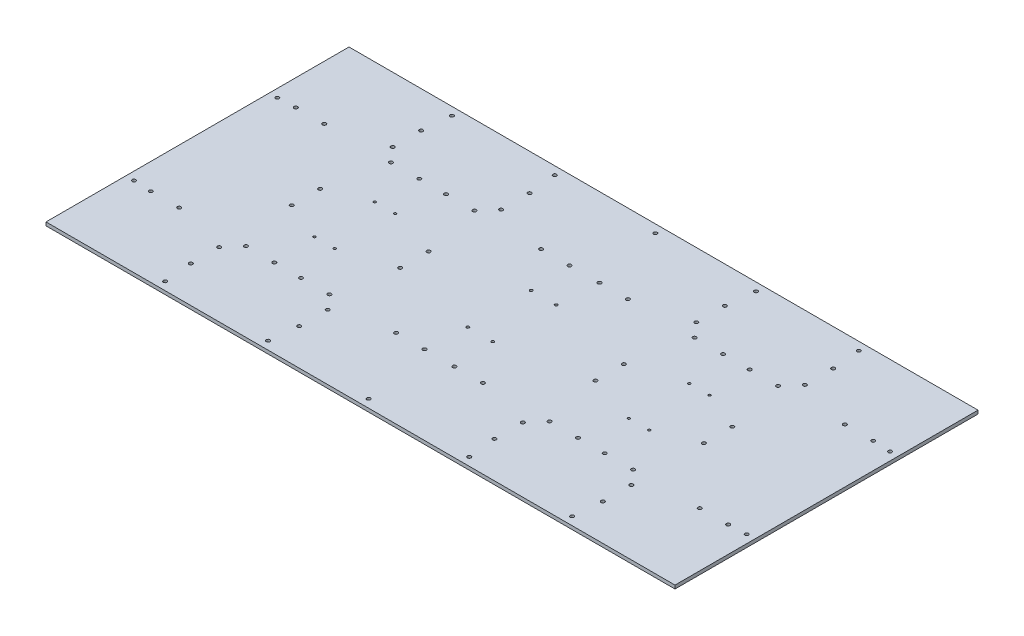
from build123d import *

# Parameters (mm, degrees)
SKETCH1_W           = 580
SKETCH1_H           = 279.4
SKETCH1_R           = 1.65
BOSS_EXTRUDE1_DEPTH = 3.175
SKETCH2_R           = 1.65
CUT_EXTRUDE1_DEPTH  = 3.175
SKETCH3_R           = 1.3
SKETCH3_R_2         = 1.1
CUT_EXTRUDE2_DEPTH  = 3.175


with BuildPart() as part:
    # Sketch1 → Boss-Extrude1 (new body)
    with BuildSketch(Plane(origin=(0, 0, 0), x_dir=(1, 0, 0), z_dir=(0, 1, 0))):
        Rectangle(SKETCH1_W, SKETCH1_H)
        with Locations(Location((-282.5, 66.1, 0), (0, 0, 270))):
            Circle(SKETCH1_R, mode=Mode.SUBTRACT)
        with Locations(Location((-187.633333333, 132.2, 0), (0, 0, 270))):
            Circle(SKETCH1_R, mode=Mode.SUBTRACT)
        with Locations(Location((-92.766666667, 132.2, 0), (0, 0, 270))):
            Circle(SKETCH1_R, mode=Mode.SUBTRACT)
        with Locations(Location((-282.5, -66.1, 0), (0, 0, 90))):
            Circle(SKETCH1_R, mode=Mode.SUBTRACT)
        with Locations(Location((-92.766666667, -132.2, 0), (0, 0, 90))):
            Circle(SKETCH1_R, mode=Mode.SUBTRACT)
        with Locations(Location((-187.633333333, -132.2, 0), (0, 0, 90))):
            Circle(SKETCH1_R, mode=Mode.SUBTRACT)
        with Locations(Location((187.633333333, -132.2, 0), (0, 0, 270))):
            Circle(SKETCH1_R, mode=Mode.SUBTRACT)
        with Locations(Location((92.766666667, -132.2, 0), (0, 0, 270))):
            Circle(SKETCH1_R, mode=Mode.SUBTRACT)
        with Locations(Location((92.766666667, 132.2, 0), (0, 0, 90))):
            Circle(SKETCH1_R, mode=Mode.SUBTRACT)
        with Locations(Location((187.633333333, 132.2, 0), (0, 0, 90))):
            Circle(SKETCH1_R, mode=Mode.SUBTRACT)
        with Locations(Location((282.5, -66.1, 0), (0, 0, 270))):
            Circle(SKETCH1_R, mode=Mode.SUBTRACT)
        with Locations(Location((282.5, 66.1, 0), (0, 0, 90))):
            Circle(SKETCH1_R, mode=Mode.SUBTRACT)
        with Locations(Location((0, 132.2, 0), (0, 0, 270))):
            Circle(SKETCH1_R, mode=Mode.SUBTRACT)
        with Locations(Location((0, -132.2, 0), (0, 0, 270))):
            Circle(SKETCH1_R, mode=Mode.SUBTRACT)
    extrude(amount=BOSS_EXTRUDE1_DEPTH)

    # Sketch2 → Cut-Extrude1 (cut)
    with BuildSketch(Plane(origin=(0, 3.175, 0), x_dir=(1, 0, 0), z_dir=(0, 1, 0))):
        with Locations(Location((-190, 13.1, 0), (0, 0, 270))):
            Circle(SKETCH2_R)
        with Locations(Location((-266.2, 66.873878157, 0), (0, 0, 270))):
            Circle(SKETCH2_R)
        with Locations(Location((-240, 66.873878157, 0), (0, 0, 270))):
            Circle(SKETCH2_R)
        with Locations(Location((-178.5, 66.873878157, 0), (0, 0, 270))):
            Circle(SKETCH2_R)
        with Locations(Location((-152.3, 66.873878157, 0), (0, 0, 270))):
            Circle(SKETCH2_R)
        with Locations(Location((-190, 106.2, 0), (0, 0, 270))):
            Circle(SKETCH2_R)
        with Locations(Location((-190, 80, 0), (0, 0, 270))):
            Circle(SKETCH2_R)
        with Locations(Location((-190, -80, 0), (0, 0, 270))):
            Circle(SKETCH2_R)
        with Locations(Location((-190, -106.2, 0), (0, 0, 270))):
            Circle(SKETCH2_R)
        with Locations(Location((-152.3, -66.873878157, 0), (0, 0, 270))):
            Circle(SKETCH2_R)
        with Locations(Location((-178.5, -66.873878157, 0), (0, 0, 270))):
            Circle(SKETCH2_R)
        with Locations(Location((-240, -66.873878157, 0), (0, 0, 270))):
            Circle(SKETCH2_R)
        with Locations(Location((-266.2, -66.873878157, 0), (0, 0, 270))):
            Circle(SKETCH2_R)
        with Locations(Location((-190, -13.1, 0), (0, 0, 270))):
            Circle(SKETCH2_R)
        with Locations(Location((-90, -13.1, 0), (0, 0, 270))):
            Circle(SKETCH2_R)
        with Locations(Location((-13.8, -66.873878157, 0), (0, 0, 270))):
            Circle(SKETCH2_R)
        with Locations(Location((-40, -66.873878157, 0), (0, 0, 270))):
            Circle(SKETCH2_R)
        with Locations(Location((-101.5, -66.873878157, 0), (0, 0, 270))):
            Circle(SKETCH2_R)
        with Locations(Location((-127.7, -66.873878157, 0), (0, 0, 270))):
            Circle(SKETCH2_R)
        with Locations(Location((-90, -106.2, 0), (0, 0, 270))):
            Circle(SKETCH2_R)
        with Locations(Location((-90, -80, 0), (0, 0, 270))):
            Circle(SKETCH2_R)
        with Locations(Location((-90, 80, 0), (0, 0, 270))):
            Circle(SKETCH2_R)
        with Locations(Location((-90, 106.2, 0), (0, 0, 270))):
            Circle(SKETCH2_R)
        with Locations(Location((-127.7, 66.873878157, 0), (0, 0, 270))):
            Circle(SKETCH2_R)
        with Locations(Location((-101.5, 66.873878157, 0), (0, 0, 270))):
            Circle(SKETCH2_R)
        with Locations(Location((-40, 66.873878157, 0), (0, 0, 270))):
            Circle(SKETCH2_R)
        with Locations(Location((-13.8, 66.873878157, 0), (0, 0, 270))):
            Circle(SKETCH2_R)
        with Locations(Location((-90, 13.1, 0), (0, 0, 270))):
            Circle(SKETCH2_R)
        with Locations(Location((90, 13.1, 0), (0, 0, 270))):
            Circle(SKETCH2_R)
        with Locations(Location((13.8, 66.873878157, 0), (0, 0, 270))):
            Circle(SKETCH2_R)
        with Locations(Location((40, 66.873878157, 0), (0, 0, 270))):
            Circle(SKETCH2_R)
        with Locations(Location((101.5, 66.873878157, 0), (0, 0, 270))):
            Circle(SKETCH2_R)
        with Locations(Location((127.7, 66.873878157, 0), (0, 0, 270))):
            Circle(SKETCH2_R)
        with Locations(Location((90, 106.2, 0), (0, 0, 270))):
            Circle(SKETCH2_R)
        with Locations(Location((90, 80, 0), (0, 0, 270))):
            Circle(SKETCH2_R)
        with Locations(Location((90, -80, 0), (0, 0, 270))):
            Circle(SKETCH2_R)
        with Locations(Location((90, -106.2, 0), (0, 0, 270))):
            Circle(SKETCH2_R)
        with Locations(Location((127.7, -66.873878157, 0), (0, 0, 270))):
            Circle(SKETCH2_R)
        with Locations(Location((101.5, -66.873878157, 0), (0, 0, 270))):
            Circle(SKETCH2_R)
        with Locations(Location((40, -66.873878157, 0), (0, 0, 270))):
            Circle(SKETCH2_R)
        with Locations(Location((13.8, -66.873878157, 0), (0, 0, 270))):
            Circle(SKETCH2_R)
        with Locations(Location((90, -13.1, 0), (0, 0, 270))):
            Circle(SKETCH2_R)
        with Locations(Location((190, -13.1, 0), (0, 0, 270))):
            Circle(SKETCH2_R)
        with Locations(Location((266.2, -66.873878157, 0), (0, 0, 270))):
            Circle(SKETCH2_R)
        with Locations(Location((240, -66.873878157, 0), (0, 0, 270))):
            Circle(SKETCH2_R)
        with Locations(Location((178.5, -66.873878157, 0), (0, 0, 270))):
            Circle(SKETCH2_R)
        with Locations(Location((152.3, -66.873878157, 0), (0, 0, 270))):
            Circle(SKETCH2_R)
        with Locations(Location((190, -106.2, 0), (0, 0, 270))):
            Circle(SKETCH2_R)
        with Locations(Location((190, -80, 0), (0, 0, 270))):
            Circle(SKETCH2_R)
        with Locations(Location((190, 80, 0), (0, 0, 270))):
            Circle(SKETCH2_R)
        with Locations(Location((190, 106.2, 0), (0, 0, 270))):
            Circle(SKETCH2_R)
        with Locations(Location((152.3, 66.873878157, 0), (0, 0, 270))):
            Circle(SKETCH2_R)
        with Locations(Location((178.5, 66.873878157, 0), (0, 0, 270))):
            Circle(SKETCH2_R)
        with Locations(Location((240, 66.873878157, 0), (0, 0, 270))):
            Circle(SKETCH2_R)
        with Locations(Location((266.2, 66.873878157, 0), (0, 0, 270))):
            Circle(SKETCH2_R)
        with Locations(Location((190, 13.1, 0), (0, 0, 270))):
            Circle(SKETCH2_R)
    extrude(amount=-CUT_EXTRUDE1_DEPTH, mode=Mode.SUBTRACT)

    # Sketch3 → Cut-Extrude2 (cut)
    with BuildSketch(Plane(origin=(0, 3.175, 0), x_dir=(1, 0, 0), z_dir=(0, 1, 0))):
        with Locations(Location((-11.525, 29.25, 0), (0, 0, 270))):
            Circle(SKETCH3_R)
        with Locations(Location((11.525, 29.25, 0), (0, 0, 270))):
            Circle(SKETCH3_R)
        with Locations(Location((11.525, -29.25, 0), (0, 0, 270))):
            Circle(SKETCH3_R)
        with Locations(Location((-11.525, -29.25, 0), (0, 0, 270))):
            Circle(SKETCH3_R)
        with Locations(Location((-154.35, 27.85, 0), (0, 0, 270))):
            Circle(SKETCH3_R_2)
        with Locations(Location((-135.65, 27.85, 0), (0, 0, 270))):
            Circle(SKETCH3_R_2)
        with Locations(Location((-135.65, -27.85, 0), (0, 0, 270))):
            Circle(SKETCH3_R_2)
        with Locations(Location((-154.35, -27.85, 0), (0, 0, 270))):
            Circle(SKETCH3_R_2)
        with Locations(Location((154.35, -27.85, 0), (0, 0, 270))):
            Circle(SKETCH3_R_2)
        with Locations(Location((135.65, -27.85, 0), (0, 0, 270))):
            Circle(SKETCH3_R_2)
        with Locations(Location((135.65, 27.85, 0), (0, 0, 270))):
            Circle(SKETCH3_R_2)
        with Locations(Location((154.35, 27.85, 0), (0, 0, 270))):
            Circle(SKETCH3_R_2)
    extrude(amount=-CUT_EXTRUDE2_DEPTH, mode=Mode.SUBTRACT)


solid = part.part
